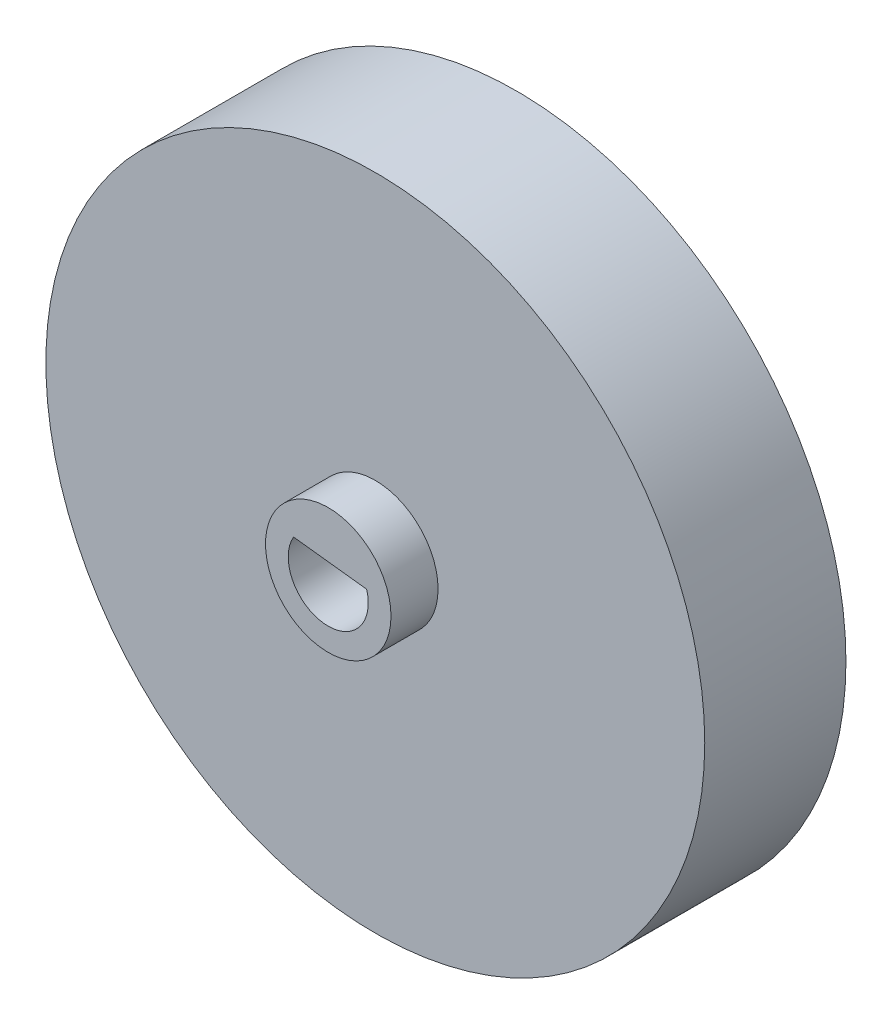
from build123d import *

# Parameters (mm, degrees)
SKETCH_1_R      = 8
EXTRUDE_1_DEPTH = 24
SKETCH_2_R      = 42
SKETCH_2_R_2    = 8
EXTRUDE_2_DEPTH = 18
EXTRUDE_3_DEPTH = 18


with BuildPart() as part:
    # 草图1 → 凸台-拉伸1 (new body)
    with BuildSketch(Plane.XY):
        Circle(SKETCH_1_R)
        with BuildLine():
            Line((4.89403723, 1.434712371), (-4.42388764, 2.537561456))
            ThreePointArc((-4.42388764, 2.537561456), (-0.599440727, -5.06464913), (4.89403723, 1.434712371))
        make_face(mode=Mode.SUBTRACT)
    extrude(amount=EXTRUDE_1_DEPTH)

    # 草图2 → 凸台-拉伸2 (add)
    with BuildSketch(Plane.XY):
        Circle(SKETCH_2_R)
        Circle(SKETCH_2_R_2, mode=Mode.SUBTRACT)
    extrude(amount=EXTRUDE_2_DEPTH)

    # 草图3 → 凸台-拉伸3 (add)
    with BuildSketch(Plane.XY):
        with BuildLine():
            Line((37.532556284, 2.035291149), (41.987004924, 1.044709313))
            ThreePointArc((41.987004924, 1.044709313), (42, 0), (41.987004924, -1.044709313))
            Line((41.987004924, -1.044709313), (37.532556284, -2.035291149))
            ThreePointArc((37.532556284, -2.035291149), (37.5877, 0), (37.532556284, 2.035291149))
        make_face()
    extrude(amount=EXTRUDE_3_DEPTH)


solid = part.part
